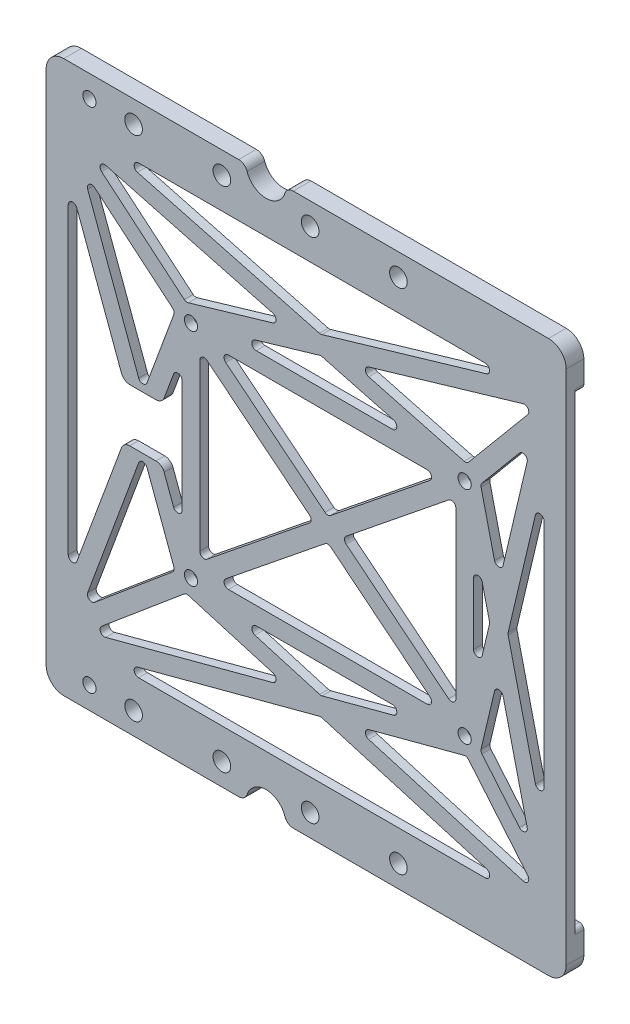
from build123d import *

# Parameters (mm, degrees)
SKETCH_1_W          = 118
SKETCH_1_H          = 125
SKETCH_1_R          = 1.5
SKETCH_1_R_2        = 2
EXTRUDE_1_DEPTH     = 4
SKETCH_2_R          = 4.5
SKETCH_2_W          = 0.2
SKETCH_2_H          = 125
CUT_EXTRUDE_1_DEPTH = 4
SKETCH_3_R          = 1.5
CUT_EXTRUDE_2_DEPTH = 4
FILLET_1_R          = 2
FILLET_2_R          = 4
SKETCH_4_W          = 117.8
SKETCH_4_H          = 105
CUT_EXTRUDE_3_DEPTH = 2
CUT_EXTRUDE_4_DEPTH = 2
EXTRUDE_2_DEPTH     = 2
FILLET_3_R          = 1
SKETCH_7_W          = 8.70252422
SKETCH_7_H          = 12
CUT_EXTRUDE_5_DEPTH = 10
FILLET_4_R          = 2


with BuildPart() as part:
    # 草图1 → 凸台-拉伸1 (new body)
    with BuildSketch(Plane.XY):
        Rectangle(SKETCH_1_W, SKETCH_1_H)
        with Locations((-49, 57.5)):
            Circle(SKETCH_1_R, mode=Mode.SUBTRACT)
        with Locations((-39, 57.5)):
            Circle(SKETCH_1_R_2, mode=Mode.SUBTRACT)
        with Locations((-19, 57.5)):
            Circle(SKETCH_1_R_2, mode=Mode.SUBTRACT)
        with Locations((1, 57.5)):
            Circle(SKETCH_1_R_2, mode=Mode.SUBTRACT)
        with Locations(Location((1, -57.5, 0), (0, 0, 180))):
            Circle(SKETCH_1_R_2, mode=Mode.SUBTRACT)
        with Locations(Location((-19, -57.5, 0), (0, 0, 180))):
            Circle(SKETCH_1_R_2, mode=Mode.SUBTRACT)
        with Locations(Location((-39, -57.5, 0), (0, 0, 180))):
            Circle(SKETCH_1_R_2, mode=Mode.SUBTRACT)
        with Locations(Location((-49, -57.5, 0), (0, 0, 180))):
            Circle(SKETCH_1_R, mode=Mode.SUBTRACT)
        with Locations((21, 57.5)):
            Circle(SKETCH_1_R_2, mode=Mode.SUBTRACT)
        with Locations(Location((21, -57.5, 0), (0, 0, 180))):
            Circle(SKETCH_1_R_2, mode=Mode.SUBTRACT)
    extrude(amount=EXTRUDE_1_DEPTH)

    # 草图2 → 切除-拉伸1 (cut)
    with BuildSketch(Plane(origin=(0, 0, 0), x_dir=(-1, 0, 0), z_dir=(0, 0, -1))):
        with Locations((9, 62.5)):
            Circle(SKETCH_2_R)
        with Locations((9, -62.5)):
            Circle(SKETCH_2_R)
        with Locations((58.9, 0)):
            Rectangle(SKETCH_2_W, SKETCH_2_H)
    extrude(amount=-CUT_EXTRUDE_1_DEPTH, mode=Mode.SUBTRACT)

    # 草图3 → 切除-拉伸2 (cut)
    with BuildSketch(Plane(origin=(0, 0, 0), x_dir=(-1, 0, 0), z_dir=(0, 0, -1))):
        with Locations((26, 25)):
            Circle(SKETCH_3_R)
        with Locations((26, -25)):
            Circle(SKETCH_3_R)
        with Locations((-36, -25)):
            Circle(SKETCH_3_R)
        with Locations((-36, 25)):
            Circle(SKETCH_3_R)
    extrude(amount=-CUT_EXTRUDE_2_DEPTH, mode=Mode.SUBTRACT)

    # 圆角1
    fillet_1_edges = [part.edges().sort_by_distance(p)[0] for p in [
        (-13.5, -62.5, 2),
        (-4.5, -62.5, 2),
        (-4.5, 62.5, 2),
        (-13.5, 62.5, 2),
    ]]
    fillet(fillet_1_edges, radius=FILLET_1_R)

    # 圆角2
    fillet_2_edges = [part.edges().sort_by_distance(p)[0] for p in [
        (-58.8, -62.5, 2),
        (-58.8, 62.5, 2),
        (59, -62.5, 2),
        (59, 62.5, 2),
    ]]
    fillet(fillet_2_edges, radius=FILLET_2_R)

    # 草图4 → 切除-拉伸3 (cut)
    with BuildSketch(Plane(origin=(0, 0, 0), x_dir=(-1, 0, 0), z_dir=(0, 0, -1))):
        with Locations((-0.1, 0)):
            Rectangle(SKETCH_4_W, SKETCH_4_H)
    extrude(amount=-CUT_EXTRUDE_3_DEPTH, mode=Mode.SUBTRACT)

    # 草图5 → 切除-拉伸4 (cut)
    with BuildSketch(Plane(origin=(0, 0, 2), x_dir=(-1, 0, 0), z_dir=(0, 0, -1))):
        Polygon((-35.065426652, -27), (-54.719972106, -50.5), (53.301605785, -50.5), (25.272514876, -27), align=None)
        Polygon((-54, 43.404314475), (-54, -43.404314475), (-38, -24.273879692), (-38, 24.273879692), align=None)
        Polygon((25.272514876, 27), (53.301605785, 50.5), (-54.719972106, 50.5), (-35.065426652, 27), align=None)
        Polygon((28, -24.066895094), (28, 24.066895094), (53.8, 45.697992655), (53.8, -45.697992655), align=None)
        Polygon((-8.18596924, 0), (-34, 20.817766742), (-34, -20.817766742), align=None)
        Polygon((-30.33403076, 23), (-5, 2.569330032), (20.33403076, 23), align=None)
        Polygon((-1.81403076, 0), (24, 20.817766742), (24, -20.817766742), align=None)
        Polygon((20.33403076, -23), (-30.33403076, -23), (-5, -2.569330032), align=None)
    extrude(amount=-CUT_EXTRUDE_4_DEPTH, mode=Mode.SUBTRACT)

    # 草图6 → 凸台-拉伸2 (add)
    with BuildSketch(Plane(origin=(0, 0, 2), x_dir=(-1, 0, 0), z_dir=(0, 0, -1))):
        Polygon((-43.738658956, 8.692973065), (-51.135036286, 39.978814382), (-54, 43.404314475), (-54, 34.711341409), (-45.793790166, 0), (-54, -34.711341409), (-54, -43.404314475), (-51.135036286, -39.978814382), (-43.738658956, -8.692973065), (-39.602232068, -26.189591947), (-38, -24.273879692), (-38, -15.580906627), (-41.683527746, 0), (-38, 15.580906627), (-38, 24.273879692), (-39.602232068, 26.189591947), align=None)
        Polygon((28, 24.066895094), (28, 18.300797704), (34.767882756, 0), (28, -18.300797704), (28, -24.066895094), (29.627700737, -25.431583212), (36.900263635, -5.76609739), (50.709337244, -43.106735771), (53.8, -45.697992655), (53.8, -39.931895265), (39.032644514, 0), (53.8, 39.931895265), (53.8, 45.697992655), (50.709337244, 43.106735771), (36.900263635, 5.76609739), (29.627700737, 25.431583212), align=None)
        Polygon((-3.422598766, -33.345461925), (-27.283434498, -27), (-35.065426652, -27), (-36.481361518, -28.692965602), (-10.817498777, -35.517917824), (-52.40865363, -47.736467039), (-54.719972106, -50.5), (-47.624402311, -50.5), (-3.368980886, -37.498748974), (45.519613631, -50.5), (53.301605785, -50.5), (49.686597384, -47.469124054), (4.025919125, -35.326293074), (27.113650459, -28.543635017), (25.272514876, -27), (18.17694508, -27), align=None)
        Polygon((53.301605785, 50.5), (45.519613631, 50.5), (-3.368980886, 37.498748974), (-47.624402311, 50.5), (-54.719972106, 50.5), (-52.40865363, 47.736467039), (-10.817498777, 35.517917824), (-36.481361518, 28.692965602), (-35.065426652, 27), (-27.283434498, 27), (-3.422598766, 33.345461925), (18.17694508, 27), (25.272514876, 27), (27.113650459, 28.543635017), (4.025919125, 35.326293074), (49.686597384, 47.469124054), align=None)
    extrude(amount=-EXTRUDE_2_DEPTH)

    # 圆角3
    fillet_3_edges = [part.edges().sort_by_distance(p)[0] for p in [
        (59, -52.5, 1),
        (59, 52.5, 1),
        (-58.8, 52.5, 1),
        (-58.8, -52.5, 1),
        (34, 20.817766742, 3),
        (8.18596924, 0, 3),
        (34, -20.817766742, 3),
        (-20.33403076, -23, 3),
        (30.33403076, -23, 3),
        (5, -2.569330032, 3),
        (5, 2.569330032, 3),
        (30.33403076, 23, 3),
        (-20.33403076, 23, 3),
        (1.81403076, 0, 3),
        (-24, 20.817766742, 3),
        (-24, -20.817766742, 3),
        (27.283434498, 27, 3),
        (36.481361518, 28.692965602, 3),
        (10.817498777, 35.517917824, 3),
        (52.40865363, 47.736467039, 3),
        (47.624402311, 50.5, 3),
        (3.368980886, 37.498748974, 3),
        (-45.519613631, 50.5, 3),
        (-49.686597384, 47.469124054, 3),
        (-4.025919125, 35.326293074, 3),
        (-27.113650459, 28.543635017, 3),
        (-18.17694508, 27, 3),
        (3.422598766, 33.345461925, 3),
        (-29.627700737, -25.431583212, 3),
        (-28, -18.300797704, 3),
        (-34.767882756, 0, 3),
        (-28, 18.300797704, 3),
        (-29.627700737, 25.431583212, 3),
        (-36.900263635, 5.76609739, 3),
        (-50.709337244, 43.106735771, 3),
        (-53.8, 39.931895265, 3),
        (-39.032644514, 0, 3),
        (-53.8, -39.931895265, 3),
        (-50.709337244, -43.106735771, 3),
        (-36.900263635, -5.76609739, 3),
        (3.368980886, -37.498748974, 3),
        (47.624402311, -50.5, 3),
        (52.40865363, -47.736467039, 3),
        (10.817498777, -35.517917824, 3),
        (36.481361518, -28.692965602, 3),
        (27.283434498, -27, 3),
        (3.422598766, -33.345461925, 3),
        (-18.17694508, -27, 3),
        (-27.113650459, -28.543635017, 3),
        (-4.025919125, -35.326293074, 3),
        (-49.686597384, -47.469124054, 3),
        (-45.519613631, -50.5, 3),
        (43.738658956, -8.692973065, 3),
        (51.135036286, -39.978814382, 3),
        (54, -34.711341409, 3),
        (45.793790166, 0, 3),
        (54, 34.711341409, 3),
        (51.135036286, 39.978814382, 3),
        (43.738658956, 8.692973065, 3),
        (39.602232068, 26.189591947, 3),
        (38, 15.580906627, 3),
        (41.683527746, 0, 3),
        (38, -15.580906627, 3),
        (39.602232068, -26.189591947, 3),
    ]]
    fillet(fillet_3_edges, radius=FILLET_3_R)

    # 草图7 → 切除-拉伸5 (cut)
    with BuildSketch(Plane(origin=(0, 0, 2), x_dir=(-1, 0, 0), z_dir=(0, 0, -1))):
        with Locations((36.900263635, 0)):
            Rectangle(SKETCH_7_W, SKETCH_7_H)
    extrude(amount=-CUT_EXTRUDE_5_DEPTH, mode=Mode.SUBTRACT)

    # 圆角4
    fillet_4_edges = [part.edges().sort_by_distance(p)[0] for p in [
        (-41.251525745, -6, 3),
        (-32.549001525, 6, 3),
        (-41.251525745, 6, 3),
        (-32.549001525, -6, 3),
    ]]
    fillet(fillet_4_edges, radius=FILLET_4_R)


solid = part.part
